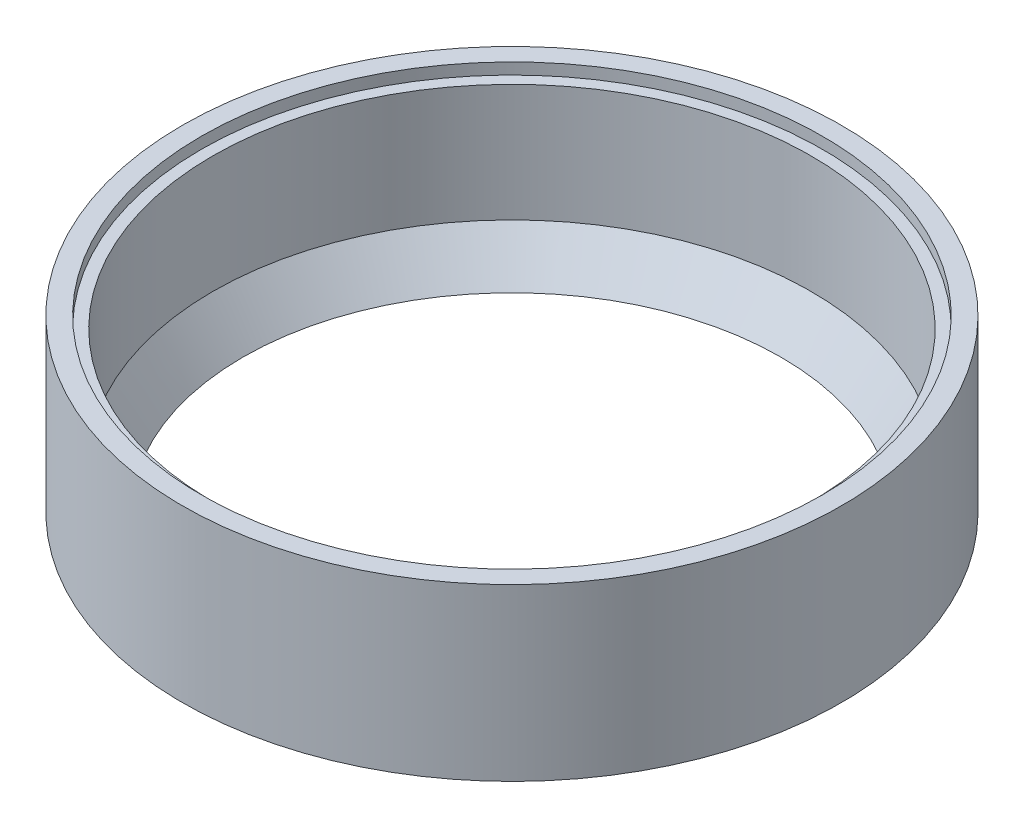
from build123d import *


with BuildPart() as part:
    # Esquisse1 → Révolution1 (revolve)
    with BuildSketch(Plane.XY, mode=Mode.PRIVATE) as r_volution1_sk:
        Polygon((71, 2.812306231), (75, 2.812306231), (75, 7.812306231), (80, 7.812306231), (80, 2.812306231), (87, 2.812306231), (87, 47.812306231), (82, 47.812306231), (82, 44.812306231), (79, 44.812306231), (79, 13.812306231), align=None)
    revolve(r_volution1_sk.sketch.rotate(Axis((0, 40.546875, 0), (0, -1, 0)), 180), axis=Axis((0, 40.546875, 0), (0, -1, 0)))


solid = part.part
